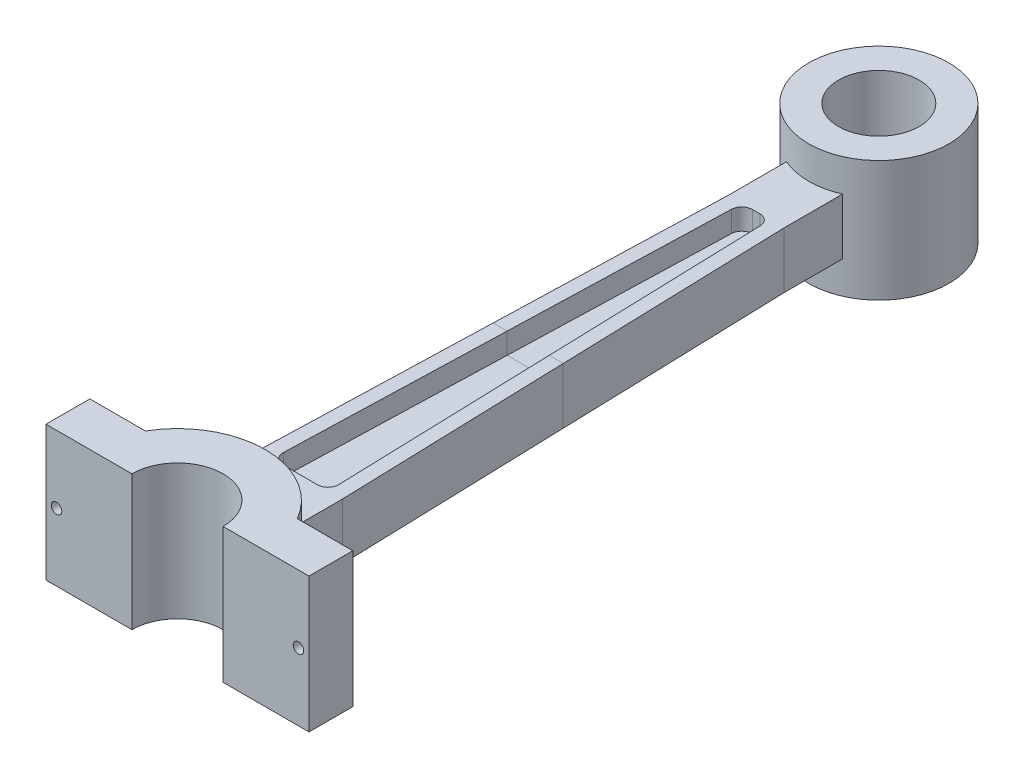
from build123d import *

# Parameters (mm, degrees)
BOSS_EXTRUDE1_DEPTH      = 34.5
BOSS_EXTRUDE1_DEPTH_BACK = 34.5
SKETCH1_R                = 40
SKETCH1_R_2              = 23
BOSS_EXTRUDE2_DEPTH      = 38.5
BOSS_EXTRUDE2_DEPTH_BACK = 38.5
BOSS_EXTRUDE4_REACH      = 337.98
BOSS_EXTRUDE4_END_RADIUS = 23
BOSS_EXTRUDE5_REACH      = 377.343
BOSS_EXTRUDE5_END_RADIUS = 26
SKETCH5_W                = 37
SKETCH5_H                = 77
SKETCH5_R                = 3
BOSS_EXTRUDE6_DEPTH      = 25
SKETCH7_W                = 26.136575601
SKETCH7_H                = 32
BOSS_EXTRUDE7_DEPTH      = 46
FILLET1_R                = 6
SKETCH8_W                = 33.33939444
SKETCH8_H                = 32
BOSS_EXTRUDE8_DEPTH      = 30
FILLET2_R                = 6


with BuildPart() as part:
    # Sketch1 → Boss-Extrude1 (new, two sides: drawn at the far end of the back side and taken through both)
    with BuildSketch(Plane(origin=(0, 0, 0), x_dir=(1, 0, 0), z_dir=(0, 1, 0)).offset(-BOSS_EXTRUDE1_DEPTH_BACK)):
        with Locations((0, 200)):
            Circle(SKETCH1_R)
        with Locations((0, 200)):
            Circle(SKETCH1_R_2, mode=Mode.SUBTRACT)
    extrude(amount=BOSS_EXTRUDE1_DEPTH + BOSS_EXTRUDE1_DEPTH_BACK)



with BuildPart() as body_2:
    # Sketch1<6> → Boss-Extrude2 (new, two sides: drawn at the far end of the back side and taken through both)
    with BuildSketch(Plane(origin=(0, 0, 0), x_dir=(1, 0, 0), z_dir=(0, 1, 0)).offset(-BOSS_EXTRUDE2_DEPTH_BACK)):
        with BuildLine():
            ThreePointArc((50, -200), (0, -150), (-50, -200))
            Line((-50, -200), (-26, -200))
            ThreePointArc((-26, -200), (0, -174), (26, -200))
            Line((26, -200), (50, -200))
        make_face()
    extrude(amount=BOSS_EXTRUDE2_DEPTH + BOSS_EXTRUDE2_DEPTH_BACK)



with BuildPart() as body_3:
    # Sketch3 → Loft1 section 0
    with BuildSketch(Plane.XY.offset(130)):
        with BuildLine():
            Line((-24, -16), (-24, 16))
            Line((-24, 16), (-16, 16))
            Line((-16, 16), (-16, 4))
            Line((-16, 4), (16, 4))
            Line((16, 4), (16, 16))
            Line((16, 16), (24, 16))
            Line((24, 16), (24, -16))
            Line((24, -16), (16, -16))
            Line((16, -16), (16, -4))
            Line((16, -4), (-16, -4))
            Line((-16, -4), (-16, -16))
            Line((-16, -16), (-24, -16))
        make_face()
    # Sketch4 → Loft1 section 1
    with BuildSketch(Plane.XY):
        with BuildLine():
            Line((-20, 16), (-12, 16))
            Line((-12, 16), (-12, 4))
            Line((-12, 4), (12, 4))
            Line((12, 4), (12, 16))
            Line((12, 16), (20, 16))
            Line((20, 16), (20, -16))
            Line((20, -16), (12, -16))
            Line((12, -16), (12, -4))
            Line((12, -4), (-12, -4))
            Line((-12, -4), (-12, -16))
            Line((-12, -16), (-20, -16))
            Line((-20, -16), (-20, 16))
        make_face()
    loft()


with BuildPart() as body_4:
    # Sketch4<3> → Loft3 section 0
    with BuildSketch(Plane.XY):
        with BuildLine():
            Line((-20, 16), (-12, 16))
            Line((-12, 16), (-12, 4))
            Line((-12, 4), (12, 4))
            Line((12, 4), (12, 16))
            Line((12, 16), (20, 16))
            Line((20, 16), (20, -16))
            Line((20, -16), (12, -16))
            Line((12, -16), (12, -4))
            Line((12, -4), (-12, -4))
            Line((-12, -4), (-12, -16))
            Line((-12, -16), (-20, -16))
            Line((-20, -16), (-20, 16))
        make_face()
    # Sketch2 → Loft3 section 1
    with BuildSketch(Plane.XY.offset(-130)):
        with BuildLine():
            Line((16, 16), (8, 16))
            Line((8, 16), (8, 4))
            Line((8, 4), (-8, 4))
            Line((-8, 4), (-8, 16))
            Line((-8, 16), (-16, 16))
            Line((-16, 16), (-16, -16))
            Line((-16, -16), (-8, -16))
            Line((-8, -16), (-8, -4))
            Line((-8, -4), (8, -4))
            Line((8, -4), (8, -16))
            Line((8, -16), (16, -16))
            Line((16, -16), (16, 16))
        make_face()
    loft()


with BuildPart() as part_1:
    add(part.part)

    add(body_4.part)  # Boss-Extrude4 merges body 4
    # Boss-Extrude4: up to this cylinder (the profile starts outside it)
    boss_extrude4_end = Plane(origin=(0, 0, -200), z_dir=(0, 1, 0)) * Cylinder(BOSS_EXTRUDE4_END_RADIUS, 722.96, mode=Mode.PRIVATE)
    # Sketch2<8> → Boss-Extrude4 (add, up to the surface)
    with BuildSketch(Plane.XY.offset(-130), mode=Mode.PRIVATE) as boss_extrude4_sk1:
        Polygon((16, 16), (8, 16), (8, 4), (-8, 4), (-8, 16), (-16, 16), (-16, -16), (-8, -16), (-8, -4), (8, -4), (8, -16), (16, -16), align=None)
    boss_extrude4_tool1 = extrude(boss_extrude4_sk1.sketch, amount=-BOSS_EXTRUDE4_REACH, mode=Mode.PRIVATE) - boss_extrude4_end
    add(boss_extrude4_tool1.solids().sort_by_distance((0, 0, -130))[0])

    # Sketch8 → Boss-Extrude8 (add)
    with BuildSketch(Plane(origin=(16, 0, 0), x_dir=(0, 0, -1), z_dir=(1, 0, 0))):
        with Locations((146.66969722, 0)):
            Rectangle(SKETCH8_W, SKETCH8_H)
    extrude(amount=-BOSS_EXTRUDE8_DEPTH)

    # Fillet2
    fillet2_edges = [part_1.edges().sort_by_distance(p)[0] for p in [
        (-8, -10, -130),
        (8, -10, -130),
        (-8, 10, -130),
        (8, 10, -130),
    ]]
    fillet(fillet2_edges, radius=FILLET2_R)


with BuildPart() as body_2_1:
    add(body_2.part)

    add(body_3.part)  # Boss-Extrude5 merges body 3
    # Boss-Extrude5: up to this cylinder (the profile starts outside it)
    boss_extrude5_end = Plane(origin=(0, 0, 200), z_dir=(0, 1, 0)) * Cylinder(BOSS_EXTRUDE5_END_RADIUS, 807.686, mode=Mode.PRIVATE)
    # Sketch3<3> → Boss-Extrude5 (add, up to the surface)
    with BuildSketch(Plane.XY.offset(130), mode=Mode.PRIVATE) as boss_extrude5_sk1:
        Polygon((-24, -16), (-24, 16), (-16, 16), (-16, 4), (16, 4), (16, 16), (24, 16), (24, -16), (16, -16), (16, -4), (-16, -4), (-16, -16), align=None)
    boss_extrude5_tool1 = extrude(boss_extrude5_sk1.sketch, amount=BOSS_EXTRUDE5_REACH, mode=Mode.PRIVATE) - boss_extrude5_end
    add(boss_extrude5_tool1.solids().sort_by_distance((0, 0, 130))[0])

    # Sketch5 → Boss-Extrude6 (add)
    # profile 1 of 2: a face of its own
    with BuildSketch(Plane.XY.offset(200)):
        with Locations((56.5, 0)):
            Rectangle(SKETCH5_W, SKETCH5_H)
        with Locations((69, 0)):
            Circle(SKETCH5_R, mode=Mode.SUBTRACT)
    # profile 2 of 2: a face of its own
    with BuildSketch(Plane.XY.offset(200)):
        with Locations((-56.5, 0)):
            Rectangle(SKETCH5_W, SKETCH5_H)
        with Locations((-69, 0)):
            Circle(SKETCH5_R, mode=Mode.SUBTRACT)
    extrude(amount=-BOSS_EXTRUDE6_DEPTH)

    # Sketch7 → Boss-Extrude7 (add)
    with BuildSketch(Plane(origin=(24, 0, 0), x_dir=(0, 0, -1), z_dir=(1, 0, 0))):
        with Locations((-143.068287801, 0)):
            Rectangle(SKETCH7_W, SKETCH7_H)
    extrude(amount=-BOSS_EXTRUDE7_DEPTH)

    # Fillet1
    fillet1_edges = [body_2_1.edges().sort_by_distance(p)[0] for p in [
        (16, 10, 130),
        (-16, 10, 130),
        (-16, -10, 130),
        (16, -10, 130),
    ]]
    fillet(fillet1_edges, radius=FILLET1_R)


solid = Compound([part_1.part, body_2_1.part])
